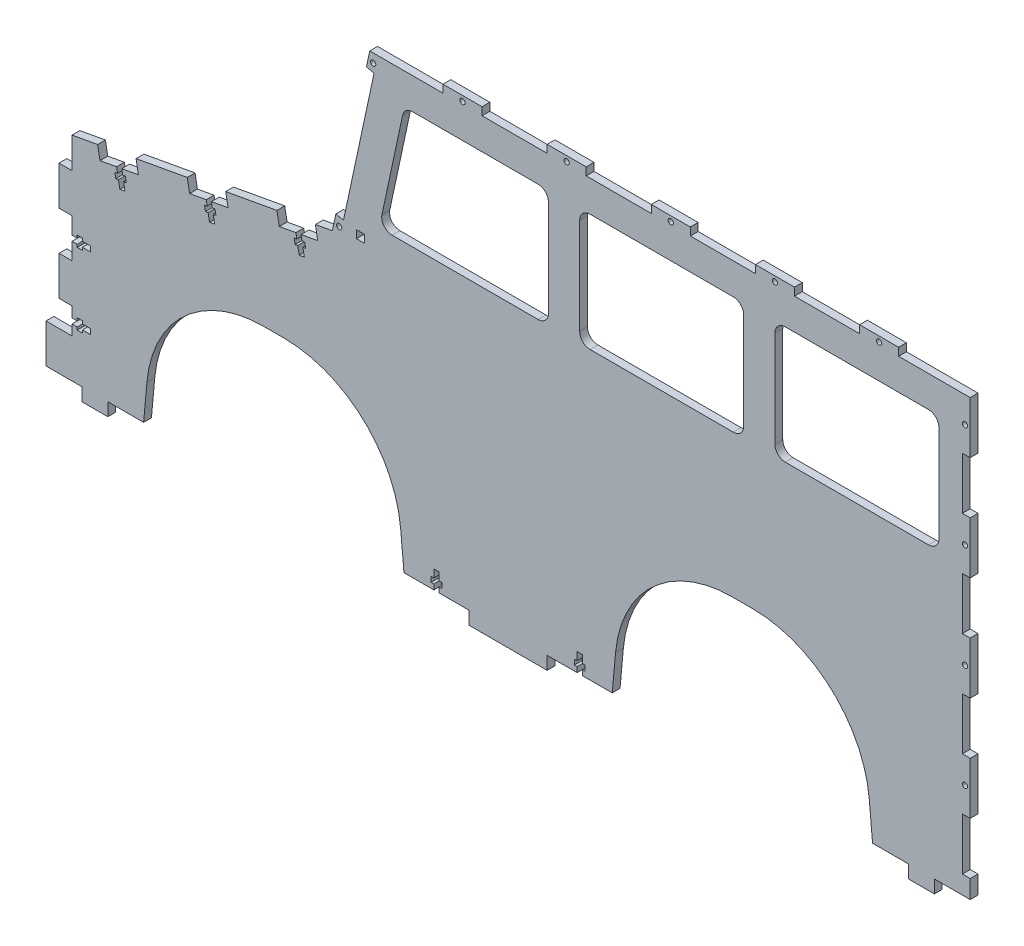
from build123d import *

# Parameters (mm, degrees)
EXTRUDE_1_DEPTH        = 3
SKETCH_3_W             = 25
SKETCH_3_H             = 3
SKETCH_3_W_2           = 27.5
CUT_EXTRUDE_1_DEPTH    = 396.801718036
SKETCH_2_R             = 1
CUT_EXTRUDE_2_DEPTH    = 396.801718036
SKETCH_4_R             = 1
CUT_EXTRUDE_3_DEPTH    = 396.801718036
SKETCH_5_W             = 3
SKETCH_5_H             = 20
CUT_EXTRUDE_4_DEPTH    = 396.801718036
SKETCH_6_W             = 52.963954937
SKETCH_6_H             = 5
SKETCH_6_W_2           = 50.247879271
CUT_EXTRUDE_5_DEPTH    = 396.801718036
SKETCH_7_W             = 24.499878537
SKETCH_7_H             = 5
SKETCH_7_W_2           = 25.63433041
SKETCH_7_W_3           = 30.65568147
SKETCH_7_W_4           = 13.75
CUT_EXTRUDE_6_DEPTH    = 396.801718036
CUT_EXTRUDE_10_DEPTH   = 396.801718036
SKETCH_12_W            = 10
SKETCH_12_H            = 114.036005351
CUT_EXTRUDE_11_DEPTH   = 396.801718036
SKETCH_13_W            = 5
SKETCH_13_H            = 15
EXTRUDE_2_DEPTH        = 3
CUT_EXTRUDE_12_DEPTH   = 396.801718036
FILLET_1_R             = 45
SKETCH_16_W            = 63
SKETCH_16_H            = 45
CUT_EXTRUDE_13_DEPTH   = 396.801718036
FILLET_2_R             = 4
SKETCH_17_W            = 3
SKETCH_17_H            = 3
CUT_EXTRUDE_14_DEPTH   = 396.801718036
CUT_EXTRUDE_15_DEPTH   = 396.801718036
PATTERN_LINEAR_1_COUNT = 2
PATTERN_LINEAR_1_PITCH = 55
CUT_EXTRUDE_16_DEPTH   = 396.801718036
CUT_EXTRUDE_17_DEPTH   = 396.801718036
SKETCH_21_R            = 1
CUT_EXTRUDE_18_DEPTH   = 396.801718036


with BuildPart() as part:
    # 草图1 → 凸台-拉伸1 (new body)
    with BuildSketch(Plane.XY):
        Polygon((0, 0), (0, 85), (110, 105), (125, 175), (355, 175), (355, 0), (317.5, 0), (317.5, 5), (312.5, 60), (222.5, 60), (217.5, 5), (217.5, 0), (137.5, 0), (137.5, 5), (132.5, 60), (42.5, 60), (37.5, 5), (37.5, 0), align=None)
    extrude(amount=EXTRUDE_1_DEPTH)

    # 草图3 → 切除-拉伸1 (cut, through all)
    with BuildSketch(Plane.XY.offset(3)):
        with Locations((180, 173.5)):
            Rectangle(SKETCH_3_W, SKETCH_3_H)
        with Locations((341.25, 173.5)):
            Rectangle(SKETCH_3_W_2, SKETCH_3_H)
        with Locations((220, 173.5)):
            Rectangle(SKETCH_3_W, SKETCH_3_H)
        with Locations((260, 173.5)):
            Rectangle(SKETCH_3_W, SKETCH_3_H)
        with Locations((300, 173.5)):
            Rectangle(SKETCH_3_W, SKETCH_3_H)
        Polygon((152.5, 175), (152.5, 172), (124.357142857, 172), (125, 175), align=None)
    extrude(amount=-CUT_EXTRUDE_1_DEPTH, mode=Mode.SUBTRACT)

    # 草图2 → 切除-拉伸2 (cut, through all)
    with BuildSketch(Plane.XY.offset(3)):
        with Locations((200, 173)):
            Circle(SKETCH_2_R)
        with Locations((240, 173)):
            Circle(SKETCH_2_R)
        with Locations((280, 173)):
            Circle(SKETCH_2_R)
        with Locations((320, 173)):
            Circle(SKETCH_2_R)
        with Locations((160, 173)):
            Circle(SKETCH_2_R)
    extrude(amount=-CUT_EXTRUDE_2_DEPTH, mode=Mode.SUBTRACT)

    # 草图4 → 切除-拉伸3 (cut, through all)
    with BuildSketch(Plane.XY.offset(3)):
        with Locations((353, 162)):
            Circle(SKETCH_4_R)
        with Locations((353, 122)):
            Circle(SKETCH_4_R)
        with Locations((353, 82)):
            Circle(SKETCH_4_R)
        with Locations((353, 42)):
            Circle(SKETCH_4_R)
    extrude(amount=-CUT_EXTRUDE_3_DEPTH, mode=Mode.SUBTRACT)

    # 草图5 → 切除-拉伸4 (cut, through all)
    with BuildSketch(Plane.XY.offset(3)):
        with Locations((353.5, 142)):
            Rectangle(SKETCH_5_W, SKETCH_5_H)
        with Locations((353.5, 102)):
            Rectangle(SKETCH_5_W, SKETCH_5_H)
        with Locations((353.5, 62)):
            Rectangle(SKETCH_5_W, SKETCH_5_H)
        with Locations((353.5, 22)):
            Rectangle(SKETCH_5_W, SKETCH_5_H)
    extrude(amount=-CUT_EXTRUDE_4_DEPTH, mode=Mode.SUBTRACT)

    # 草图6 → 切除-拉伸5 (cut, through all)
    with BuildSketch(Plane.XY.offset(3)):
        with Locations((136.018022532, 2.5)):
            Rectangle(SKETCH_6_W, SKETCH_6_H)
        with Locations((217.623939635, 2.5)):
            Rectangle(SKETCH_6_W_2, SKETCH_6_H)
    extrude(amount=-CUT_EXTRUDE_5_DEPTH, mode=Mode.SUBTRACT)

    # 草图7 → 切除-拉伸6 (cut, through all)
    with BuildSketch(Plane.XY.offset(3)):
        with Locations((1.500060731, 2.5)):
            Rectangle(SKETCH_7_W, SKETCH_7_H)
        with Locations((36.567165205, 2.5)):
            Rectangle(SKETCH_7_W_2, SKETCH_7_H)
        with Locations((315.922159265, 2.5)):
            Rectangle(SKETCH_7_W_3, SKETCH_7_H)
        with Locations((348.125, 2.5)):
            Rectangle(SKETCH_7_W_4, SKETCH_7_H)
    extrude(amount=-CUT_EXTRUDE_6_DEPTH, mode=Mode.SUBTRACT)

    # 草图11 → 切除-拉伸10 (cut, through all)
    with BuildSketch(Plane.XY.offset(3)):
        Polygon((114.275152951, 110.632892707), (111.341745709, 111.261479973), (123.075374677, 166.018415161), (126.00878192, 165.389827895), align=None)
    extrude(amount=-CUT_EXTRUDE_10_DEPTH, mode=Mode.SUBTRACT)

    # 草图12 → 切除-拉伸11 (cut, through all)
    with BuildSketch(Plane.XY.offset(3)):
        with Locations((5, 77.018002676)):
            Rectangle(SKETCH_12_W, SKETCH_12_H)
    extrude(amount=-CUT_EXTRUDE_11_DEPTH, mode=Mode.SUBTRACT)

    # 草图13 → 凸台-拉伸2 (add)
    with BuildSketch(Plane.XY.offset(3)):
        with Locations((7.5, 37.5)):
            Rectangle(SKETCH_13_W, SKETCH_13_H)
        with Locations((7.5, 67.5)):
            Rectangle(SKETCH_13_W, SKETCH_13_H)
    extrude(amount=-EXTRUDE_2_DEPTH)

    # 草图15 → 切除-拉伸12 (cut, through all)
    with BuildSketch(Plane.XY.offset(3)):
        Polygon((35.491174943, 86.370968223), (34.596747752, 91.290317773), (19.838699101, 88.6070362), (20.733126292, 83.68768665), align=None)
        Polygon((54.274145954, 94.868026537), (55.168573145, 89.948676987), (69.926621797, 92.63195856), (69.032194606, 97.55130811), align=None)
        Polygon((88.709592808, 101.129016874), (89.604019999, 96.209667324), (104.36206865, 98.892948897), (103.467641459, 103.812298447), align=None)
    extrude(amount=-CUT_EXTRUDE_12_DEPTH, mode=Mode.SUBTRACT)

    # 圆角1
    fillet_1_edges = [part.edges().sort_by_distance(p)[0] for p in [
        (312.5, 60, 1.5),
        (222.5, 60, 1.5),
        (132.5, 60, 1.5),
        (42.5, 60, 1.5),
    ]]
    fillet(fillet_1_edges, radius=FILLET_1_R)

    # 草图16 → 切除-拉伸13 (cut, through all)
    with BuildSketch(Plane.XY.offset(3)):
        with Locations((236.5, 137.5)):
            Rectangle(SKETCH_16_W, SKETCH_16_H)
        with Locations((311.5, 137.5)):
            Rectangle(SKETCH_16_W, SKETCH_16_H)
        Polygon((128, 115), (193, 115), (193, 160), (137.642857143, 160), align=None)
    extrude(amount=-CUT_EXTRUDE_13_DEPTH, mode=Mode.SUBTRACT)

    # 圆角2
    fillet_2_edges = [part.edges().sort_by_distance(p)[0] for p in [
        (128, 115, 1.5),
        (137.642857143, 160, 1.5),
        (193, 160, 1.5),
        (193, 115, 1.5),
        (280, 115, 1.5),
        (280, 160, 1.5),
        (343, 160, 1.5),
        (343, 115, 1.5),
        (205, 115, 1.5),
        (205, 160, 1.5),
        (268, 160, 1.5),
        (268, 115, 1.5),
    ]]
    fillet(fillet_2_edges, radius=FILLET_2_R)

    # 草图17 → 切除-拉伸14 (cut, through all)
    with BuildSketch(Plane.XY.offset(3)):
        with Locations((120.775152951, 108.5)):
            Rectangle(SKETCH_17_W, SKETCH_17_H)
    extrude(amount=-CUT_EXTRUDE_14_DEPTH, mode=Mode.SUBTRACT)

    # 草图18 → 切除-拉伸15 (cut, through all)
    with BuildSketch(Plane.XY.offset(3)):
        Polygon((149, 5), (151, 5), (151, 7), (152.05, 7), (152.05, 9), (151, 9), (151, 12), (149, 12), (149, 9), (147.95, 9), (147.95, 7), (149, 7), align=None)
    cut_extrude_15 = extrude(amount=-CUT_EXTRUDE_15_DEPTH, mode=Mode.SUBTRACT)

    # 阵列(线性)1: 切除-拉伸15 ×2
    with Locations(*[(i * PATTERN_LINEAR_1_PITCH, 0, 0) for i in range(1, PATTERN_LINEAR_1_COUNT)]):
        add(cut_extrude_15, mode=Mode.SUBTRACT)

    # 草图19 → 切除-拉伸16 (cut, through all)
    with BuildSketch(Plane.XY.offset(3)):
        Polygon((10, 53.5), (12, 53.5), (12, 54.55), (14, 54.55), (14, 53.5), (17, 53.5), (17, 51.5), (14, 51.5), (14, 50.45), (12, 50.45), (12, 51.5), (10, 51.5), align=None)
        Polygon((10, 26), (12, 26), (12, 27.05), (14, 27.05), (14, 26), (17, 26), (17, 24), (14, 24), (14, 22.95), (12, 22.95), (12, 24), (10, 24), align=None)
        Polygon((27.128280708, 84.850441998), (29.096020528, 85.208212874), (29.453791404, 83.240473054), (30.48685481, 83.428302764), (30.844625686, 81.460562944), (29.811562281, 81.272733234), (30.348218595, 78.321123504), (28.380478775, 77.963352627), (27.84382246, 80.914962358), (26.810759055, 80.727132647), (26.452988178, 82.694872468), (27.486051584, 82.882702178), align=None)
    extrude(amount=-CUT_EXTRUDE_16_DEPTH, mode=Mode.SUBTRACT)

    # 草图20 → 切除-拉伸17 (cut, through all)
    with BuildSketch(Plane.XY.offset(3)):
        Polygon((61.563727561, 91.111432335), (61.921498438, 89.143692515), (60.888435032, 88.955862805), (61.246205908, 86.988122984), (62.279269314, 87.175952695), (62.815925629, 84.224342964), (64.783665449, 84.582113841), (64.247009134, 87.533723571), (65.28007254, 87.721553281), (64.922301663, 89.689293101), (63.889238258, 89.501463391), (63.531467381, 91.469203211), align=None)
        Polygon((95.999174415, 97.372422672), (96.356945291, 95.404682852), (95.323881885, 95.216853142), (95.681652762, 93.249113321), (96.714716167, 93.436943032), (97.251372482, 90.485333301), (99.219112302, 90.843104178), (98.682455988, 93.794713908), (99.715519393, 93.982543618), (99.357748517, 95.950283438), (98.324685111, 95.762453728), (97.966914235, 97.730193548), align=None)
    extrude(amount=-CUT_EXTRUDE_17_DEPTH, mode=Mode.SUBTRACT)

    # 草图21 → 切除-拉伸18 (cut, through all)
    with BuildSketch(Plane.XY.offset(3)):
        with Locations((125.671863595, 168.590149403)):
            Circle(SKETCH_21_R)
        with Locations((112.626477682, 107.711681809)):
            Circle(SKETCH_21_R)
    extrude(amount=-CUT_EXTRUDE_18_DEPTH, mode=Mode.SUBTRACT)


solid = part.part
